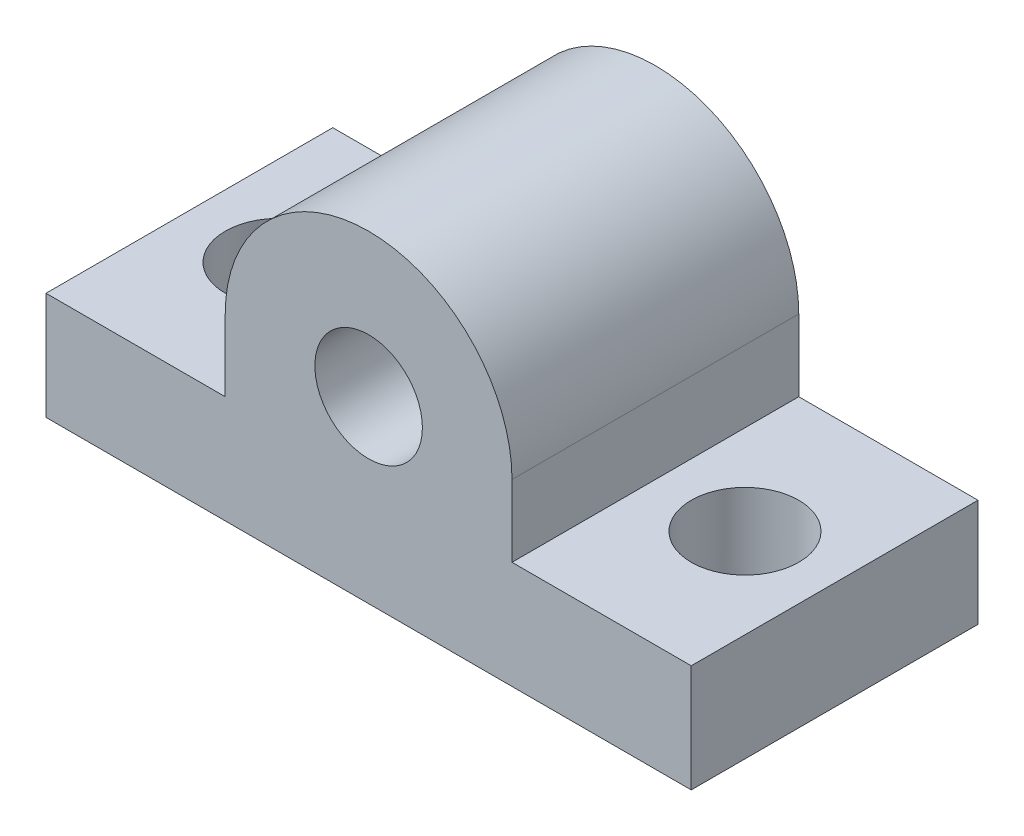
from build123d import *

# Parameters (mm, degrees)
BOSS_EXTRUDE1_DEPTH = 8
SKETCH2_W           = 8
SKETCH2_H           = 3
BOSS_EXTRUDE2_DEPTH = 5
CUT_EXTRUDE1_REACH  = 18.401
SKETCH3_R           = 1.5
SKETCH4_W           = 8
SKETCH4_H           = 3
BOSS_EXTRUDE3_DEPTH = 5
CUT_EXTRUDE2_REACH  = 18.401
SKETCH5_R           = 1.5


with BuildPart() as part:
    # Sketch1 → Boss-Extrude1 (new body)
    with BuildSketch(Plane.XY):
        with BuildLine():
            ThreePointArc((8, 5), (4, 9), (0, 5))
            Line((0, 5), (2.5, 5))
            ThreePointArc((2.5, 5), (4, 6.5), (5.5, 5))
            Line((5.5, 5), (8, 5))
        make_face()
        with BuildLine():
            Line((2.5, 5), (0, 5))
            ThreePointArc((0, 5), (4, 1), (8, 5))
            Line((8, 5), (5.5, 5))
            ThreePointArc((5.5, 5), (4, 3.5), (2.5, 5))
        make_face()
        with BuildLine():
            Line((0, 5), (0, 0))
            Line((0, 0), (8, 0))
            Line((8, 0), (8, 5))
            ThreePointArc((8, 5), (4, 1), (0, 5))
        make_face()
    extrude(amount=BOSS_EXTRUDE1_DEPTH)

    # Sketch2 → Boss-Extrude2 (add)
    with BuildSketch(Plane(origin=(8, 0, 0), x_dir=(0, 0, -1), z_dir=(1, 0, 0))):
        with Locations((-4, 1.5)):
            Rectangle(SKETCH2_W, SKETCH2_H)
    extrude(amount=BOSS_EXTRUDE2_DEPTH)

    # Sketch3 → Cut-Extrude1 (cut, up to next)
    with BuildSketch(Plane(origin=(0, 3, 0), x_dir=(1, 0, 0), z_dir=(0, 1, 0)), mode=Mode.PRIVATE) as cut_extrude1_sk1:
        with Locations(Location((10.5, -4, 0), (0, 0, 270))):
            Circle(SKETCH3_R)
    cut_extrude1_tool1 = extrude(cut_extrude1_sk1.sketch, amount=-CUT_EXTRUDE1_REACH, mode=Mode.PRIVATE) & part.part
    add(cut_extrude1_tool1.solids().sort_by_distance((10.5, 3, 4))[0], mode=Mode.SUBTRACT)

    # Sketch4 → Boss-Extrude3 (add)
    with BuildSketch(Plane.ZY):
        with Locations((4, 1.5)):
            Rectangle(SKETCH4_W, SKETCH4_H)
    extrude(amount=BOSS_EXTRUDE3_DEPTH)

    # Sketch5 → Cut-Extrude2 (cut, up to next)
    with BuildSketch(Plane(origin=(0, 3, 0), x_dir=(1, 0, 0), z_dir=(0, 1, 0)), mode=Mode.PRIVATE) as cut_extrude2_sk1:
        with Locations(Location((-2.5, -4, 0), (0, 0, 180))):
            Circle(SKETCH5_R)
    cut_extrude2_tool1 = extrude(cut_extrude2_sk1.sketch, amount=-CUT_EXTRUDE2_REACH, mode=Mode.PRIVATE) & part.part
    add(cut_extrude2_tool1.solids().sort_by_distance((-2.5, 3, 4))[0], mode=Mode.SUBTRACT)


solid = part.part
